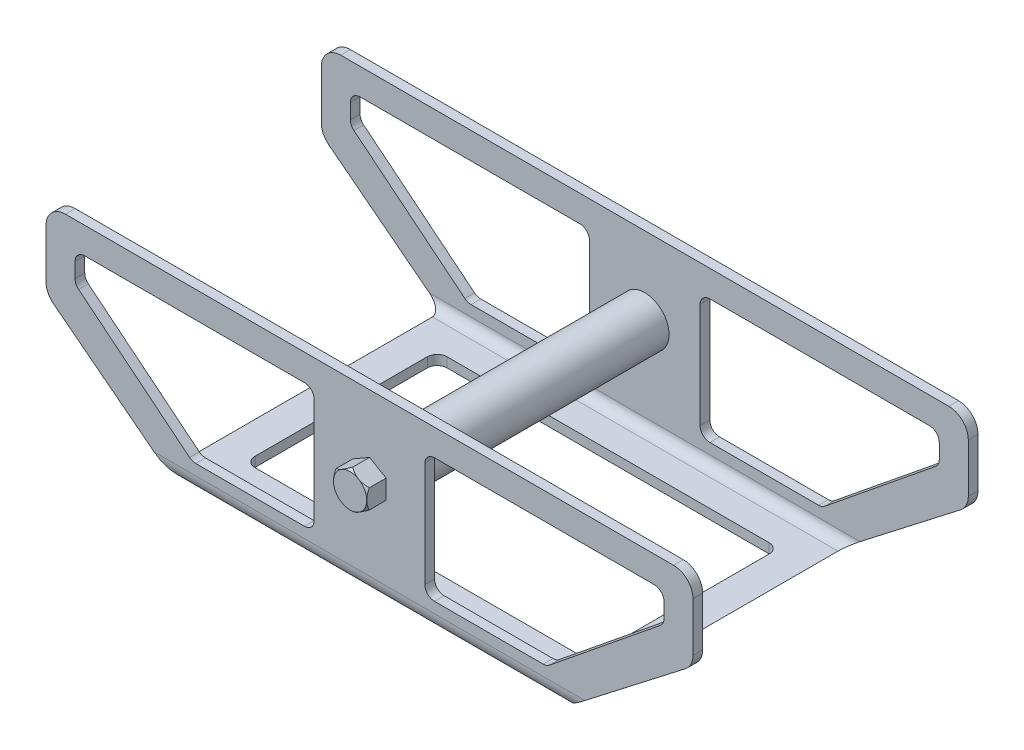
from build123d import *

# Parameters (mm, degrees)
BOSS_EXTRUDE1_DEPTH     = 146.875
SKETCH2_W               = 273.75
SKETCH2_H               = 213.261995914
CUT_EXTRUDE1_DEPTH      = 708.854574743
FILLET1_R               = 10
FILLET2_R               = 20
SKETCH3_R               = 25
BOSS_EXTRUDE2_DEPTH     = 273.75
BOSS_EXTRUDE3_DEPTH     = 20
SKETCH5_R               = 51.111383935
SKETCH5_R_2             = 17.147302995
CUT_EXTRUDE2_DEPTH      = 20
CUT_EXTRUDE2_TAPER      = 45
CUT_EXTRUDE3_DEPTH      = 495.366464437
CUT_EXTRUDE3_DEPTH_BACK = 495.366464437
CUT_EXTRUDE4_DEPTH      = 417.900952607
CUT_EXTRUDE4_DEPTH_BACK = 10
FILLET3_R               = 20


with BuildPart() as part:
    # Sketch1 → Boss-Extrude1 (new, symmetric)
    with BuildSketch(Plane.XY):
        Polygon((-333.43, 0), (333.43, 0), (333.43, -80.23), (196.11, -186.50354892), (-196.11, -186.50354892), (-333.43, -80.23), align=None)
    extrude(amount=BOSS_EXTRUDE1_DEPTH, both=True)

    # Sketch2 → Cut-Extrude1 (cut, through all)
    with BuildSketch(Plane(origin=(333.43, 0, 0), x_dir=(0, 0, -1), z_dir=(1, 0, 0))):
        with Locations((0, -69.872550963)):
            Rectangle(SKETCH2_W, SKETCH2_H)
    extrude(amount=-CUT_EXTRUDE1_DEPTH, mode=Mode.SUBTRACT)

    # Fillet1
    fillet1_edges = [part.edges().sort_by_distance(p)[0] for p in [
        (0, -176.50354892, -136.875),
        (0, -176.50354892, 136.875),
    ]]
    fillet(fillet1_edges, radius=FILLET1_R)

    # Fillet2
    fillet2_edges = [part.edges().sort_by_distance(p)[0] for p in [
        (0, -186.50354892, -146.875),
        (0, -186.50354892, 146.875),
    ]]
    fillet(fillet2_edges, radius=FILLET2_R)

    # Sketch3 → Boss-Extrude2 (add)
    with BuildSketch(Plane(origin=(0, 0, 136.875), x_dir=(-1, 0, 0), z_dir=(0, 0, -1))):
        with Locations(Location((0, -80.23, 0), (0, 0, 270))):
            Circle(SKETCH3_R)
    extrude(amount=BOSS_EXTRUDE2_DEPTH)

    # Sketch4 → Boss-Extrude3 (add)
    with BuildSketch(Plane.XY.offset(146.875)):
        Polygon((0, -100.03), (17.147302995, -90.13), (17.147302995, -70.33), (0, -60.43), (-17.147302995, -70.33), (-17.147302995, -90.13), align=None)
    boss_extrude3 = extrude(amount=BOSS_EXTRUDE3_DEPTH)

    # Sketch5 → Cut-Extrude2 (cut)
    with BuildSketch(Plane.XY.offset(166.875)):
        with Locations((0, -80.23)):
            Circle(SKETCH5_R)
        with Locations((0, -80.23)):
            Circle(SKETCH5_R_2, mode=Mode.SUBTRACT)
    cut_extrude2 = extrude(amount=-CUT_EXTRUDE2_DEPTH, taper=CUT_EXTRUDE2_TAPER, mode=Mode.SUBTRACT)

    # Mirror1: Boss-Extrude3, Cut-Extrude2 across plane
    add(boss_extrude3.mirror(Plane.XY))
    add(cut_extrude2.mirror(Plane.XY), mode=Mode.SUBTRACT)

    # Sketch6 → Cut-Extrude3 (cut, two sides: drawn at the far end of the back side and taken through both)
    with BuildSketch(Plane.XY.offset(146.875).offset(-CUT_EXTRUDE3_DEPTH_BACK)):
        with BuildLine():
            Line((-303.5, -37.26), (-303.5, -52.66))
            ThreePointArc((-303.5, -52.66), (-302.527520815, -56.961612248), (-299.799226414, -60.426578821))
            Line((-299.799226414, -60.426578821), (-185.419226414, -153.196578821))
            ThreePointArc((-185.419226414, -153.196578821), (-182.461721995, -154.855120376), (-179.12, -155.43))
            Line((-179.12, -155.43), (-67, -155.43))
            ThreePointArc((-67, -155.43), (-59.928932188, -152.501067812), (-57, -145.43))
            Line((-57, -145.43), (-57, -37.26))
            ThreePointArc((-57, -37.26), (-59.928932188, -30.188932188), (-67, -27.26))
            Line((-67, -27.26), (-293.5, -27.26))
            ThreePointArc((-293.5, -27.26), (-300.571067812, -30.188932188), (-303.5, -37.26))
        make_face()
        with BuildLine():
            Line((57, -145.43), (57, -37.26))
            ThreePointArc((57, -37.26), (59.928932188, -30.188932188), (67, -27.26))
            Line((67, -27.26), (293.5, -27.26))
            ThreePointArc((293.5, -27.26), (300.571067812, -30.188932188), (303.5, -37.26))
            Line((303.5, -37.26), (303.5, -52.66))
            ThreePointArc((303.5, -52.66), (302.527520815, -56.961612248), (299.799226414, -60.426578821))
            Line((299.799226414, -60.426578821), (185.419226414, -153.196578821))
            ThreePointArc((185.419226414, -153.196578821), (182.461721995, -154.855120376), (179.12, -155.43))
            Line((179.12, -155.43), (67, -155.43))
            ThreePointArc((67, -155.43), (59.928932188, -152.501067812), (57, -145.43))
        make_face()
    extrude(amount=CUT_EXTRUDE3_DEPTH + CUT_EXTRUDE3_DEPTH_BACK, mode=Mode.SUBTRACT)

    # Sketch7 → Cut-Extrude4 (cut, two sides: drawn at the far end of the back side and taken through both)
    with BuildSketch(Plane.XZ.offset(186.50354892).offset(-CUT_EXTRUDE4_DEPTH_BACK)):
        with BuildLine():
            Line((166.11, 99), (-166.11, 99))
            ThreePointArc((-166.11, 99), (-173.181067812, 96.071067812), (-176.11, 89))
            Line((-176.11, 89), (-176.11, -89))
            ThreePointArc((-176.11, -89), (-173.181067812, -96.071067812), (-166.11, -99))
            Line((-166.11, -99), (166.11, -99))
            ThreePointArc((166.11, -99), (173.181067812, -96.071067812), (176.11, -89))
            Line((176.11, -89), (176.11, 89))
            ThreePointArc((176.11, 89), (173.181067812, 96.071067812), (166.11, 99))
        make_face()
    extrude(amount=CUT_EXTRUDE4_DEPTH + CUT_EXTRUDE4_DEPTH_BACK, mode=Mode.SUBTRACT)

    # Fillet3
    fillet3_edges = [part.edges().sort_by_distance(p)[0] for p in [
        (-333.43, -80.23, 141.875),
        (-333.43, 0, 141.875),
        (333.43, 0, 141.875),
        (333.43, -80.23, 141.875),
        (-333.43, -80.23, -141.875),
        (-333.43, 0, -141.875),
        (333.43, 0, -141.875),
        (333.43, -80.23, -141.875),
    ]]
    fillet(fillet3_edges, radius=FILLET3_R)


solid = part.part
